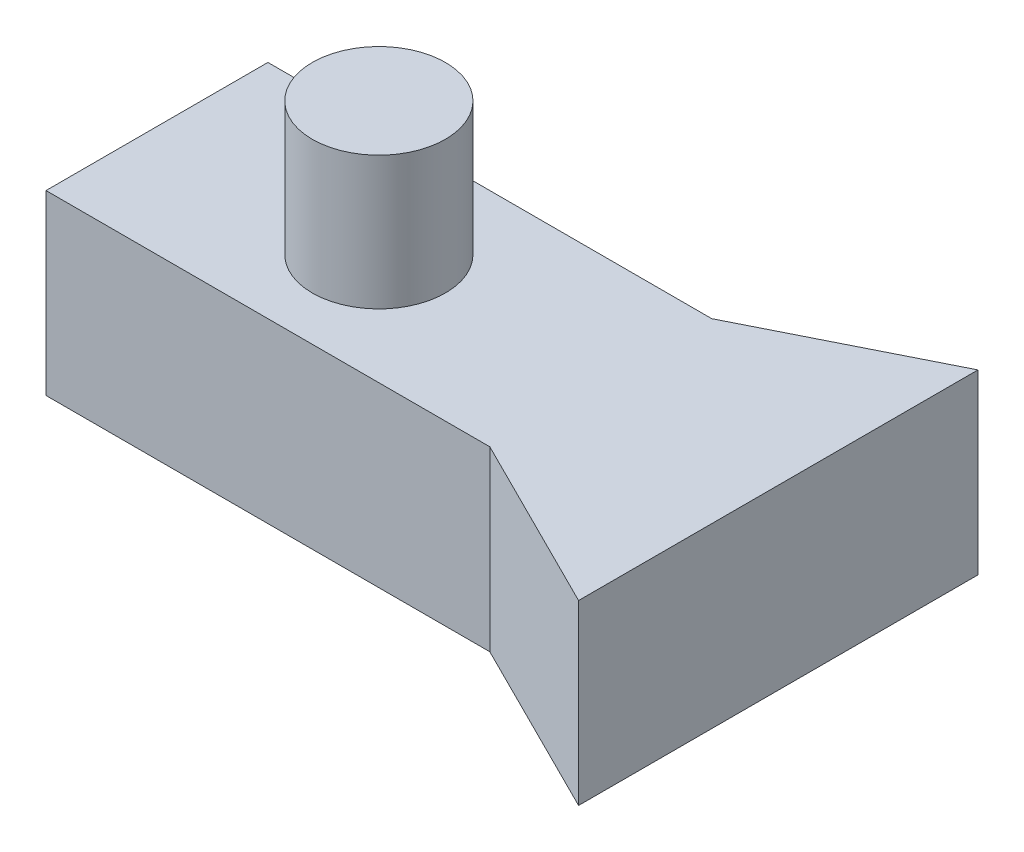
from build123d import *

# Parameters (mm, degrees)
SKETCH1_W           = 1000
SKETCH1_H           = 500
BOSS_EXTRUDE1_DEPTH = 400
SKETCH2_R           = 150
BOSS_EXTRUDE2_DEPTH = 300


with BuildPart() as part:
    # Sketch1 → Boss-Extrude1 (new body)
    with BuildSketch(Plane(origin=(0, 0, 0), x_dir=(1, 0, 0), z_dir=(0, 1, 0))):
        Polygon((1400, -200), (1000, 0), (1000, 500), (1400, 700), align=None)
        with Locations((500, 250)):
            Rectangle(SKETCH1_W, SKETCH1_H)
    extrude(amount=BOSS_EXTRUDE1_DEPTH)

    # Sketch2 → Boss-Extrude2 (add)
    with BuildSketch(Plane(origin=(0, 400, 0), x_dir=(1, 0, 0), z_dir=(0, 1, 0))):
        with Locations(Location((500, 250, 0), (0, 0, 270))):
            Circle(SKETCH2_R)
    extrude(amount=BOSS_EXTRUDE2_DEPTH)


solid = part.part
